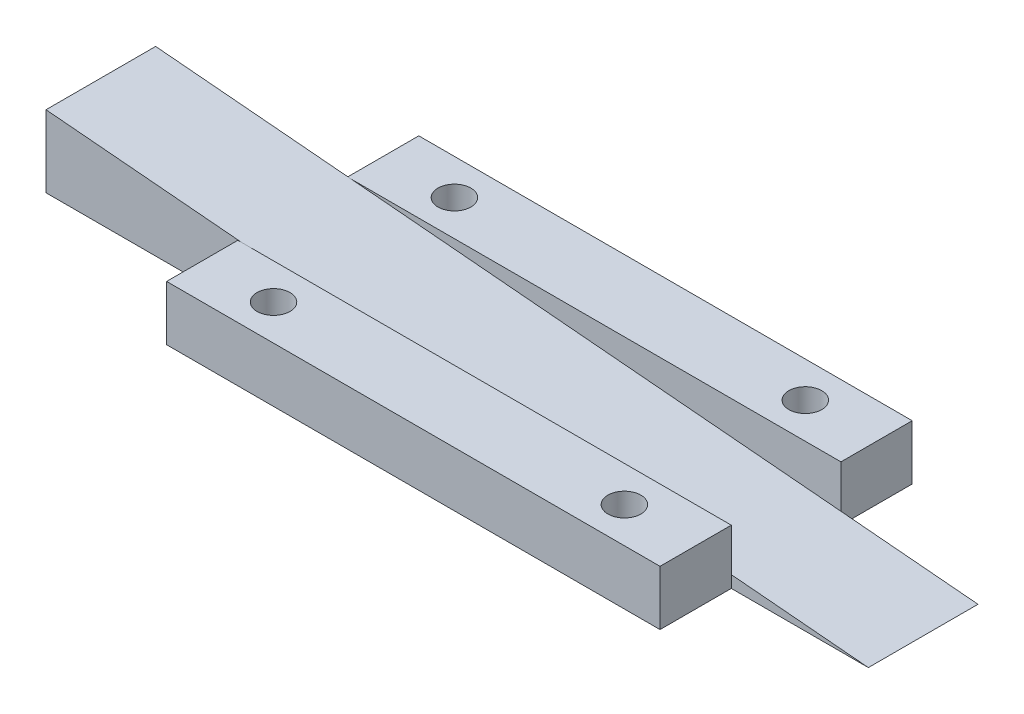
from build123d import *

# Parameters (mm, degrees)
BOSS_EXTRUDE1_DEPTH = 10
SKETCH2_W           = 90
SKETCH2_H           = 10
BOSS_EXTRUDE2_DEPTH = 13
SKETCH3_W           = 90
SKETCH3_H           = 10
BOSS_EXTRUDE3_DEPTH = 13
SKETCH4_R           = 3
CUT_EXTRUDE2_DEPTH  = 13


with BuildPart() as part:
    # Sketch1 → Boss-Extrude1 (new, symmetric)
    with BuildSketch(Plane.XY):
        Polygon((-49.027757444, 0), (100.972242556, 0), (-49.027757444, 13.123299529), align=None)
    extrude(amount=BOSS_EXTRUDE1_DEPTH, both=True)

    # Sketch2 → Boss-Extrude2 (add)
    with BuildSketch(Plane.XY.offset(10)):
        with Locations((30.972242556, 5)):
            Rectangle(SKETCH2_W, SKETCH2_H)
    extrude(amount=BOSS_EXTRUDE2_DEPTH)

    # Sketch3 → Boss-Extrude3 (add)
    with BuildSketch(Plane.XY.offset(-10)):
        with Locations((30.972242556, 5)):
            Rectangle(SKETCH3_W, SKETCH3_H)
    extrude(amount=-BOSS_EXTRUDE3_DEPTH)

    # Sketch4 → Cut-Extrude2 (cut)
    with BuildSketch(Plane.XZ.offset(-10)):
        with Locations(Location((-1.027757444, 16.5, 0), (0, 0, 180))):
            Circle(SKETCH4_R)
        with Locations(Location((62.972242556, 16.5, 0), (0, 0, 180))):
            Circle(SKETCH4_R)
        with Locations(Location((62.972242556, -16.5, 0), (0, 0, 180))):
            Circle(SKETCH4_R)
        with Locations(Location((-1.027757444, -16.5, 0), (0, 0, 180))):
            Circle(SKETCH4_R)
    extrude(amount=CUT_EXTRUDE2_DEPTH, mode=Mode.SUBTRACT)


solid = part.part
